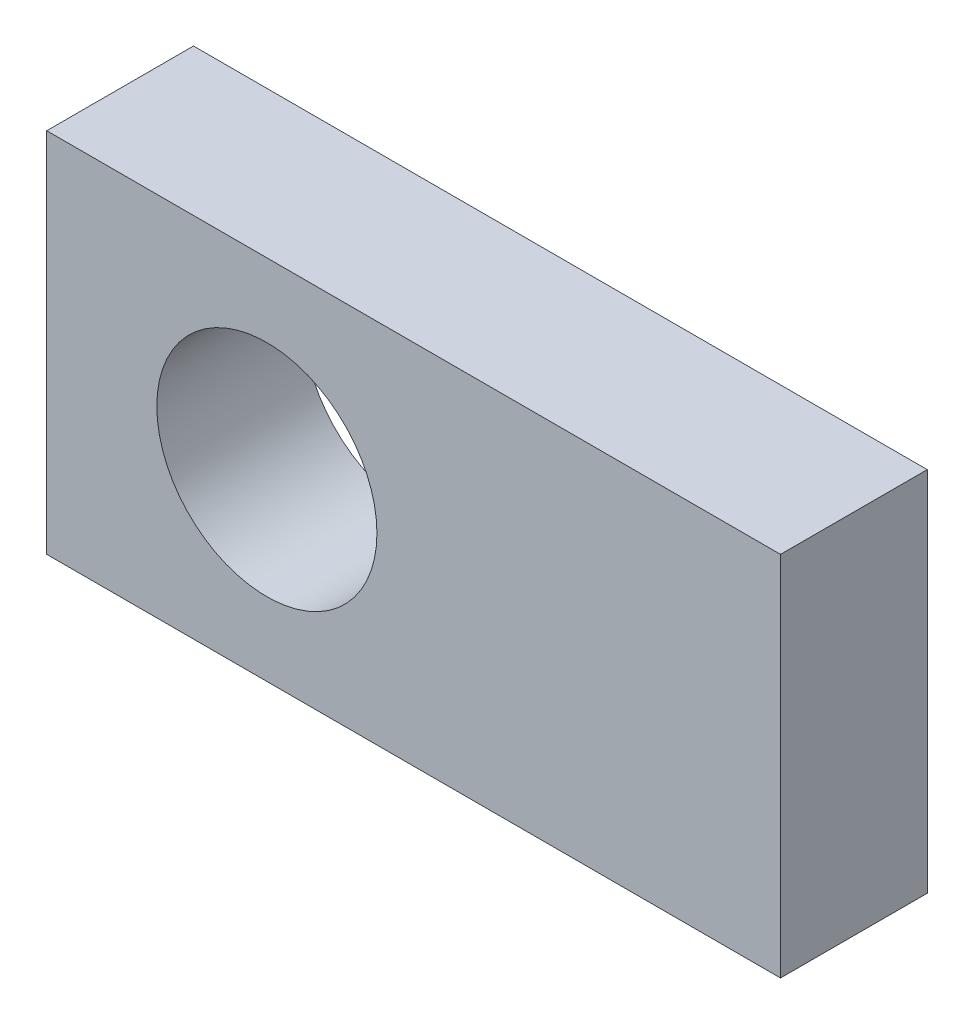
from build123d import *

# Parameters (mm, degrees)
SKETCH1_W           = 20
SKETCH1_H           = 10
SKETCH1_R           = 3
BOSS_EXTRUDE1_DEPTH = 4


with BuildPart() as part:
    # Sketch1 → Boss-Extrude1 (new body)
    with BuildSketch(Plane.XY):
        with Locations((10, 5)):
            Rectangle(SKETCH1_W, SKETCH1_H)
        with Locations((6, 5)):
            Circle(SKETCH1_R, mode=Mode.SUBTRACT)
    extrude(amount=BOSS_EXTRUDE1_DEPTH)


solid = part.part
